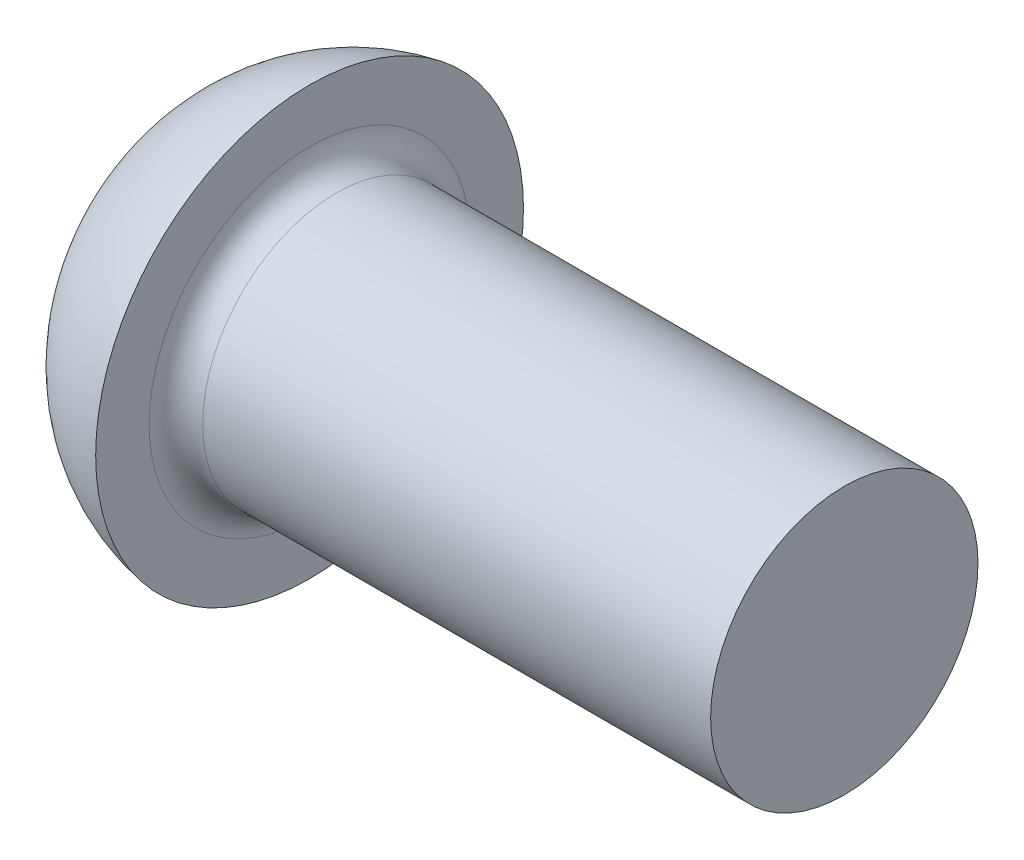
from build123d import *

# Parameters (mm, degrees)
FILLET2_R = 0.2


with BuildPart() as part:
    # Sketch1 → Revolve1 (revolve)
    with BuildSketch(Plane(origin=(0, 0, 0), x_dir=(1, 0, 0), z_dir=(0, 1, 0)), mode=Mode.PRIVATE) as revolve1_sk:
        with BuildLine():
            Line((1.2, 1), (5.2, 1))
            Line((5.2, 1), (5.2, 0))
            Line((5.2, 0), (0, 0))
            ThreePointArc((0, 0), (0.017270008, 0.28132505), (0.068820682, 0.55842533))
            ThreePointArc((0.068820682, 0.55842533), (0.478612062, 1.248413967), (1.2, 1.6))
            Line((1.2, 1.6), (1.2, 1))
        make_face()
    revolve(revolve1_sk.sketch.rotate(Axis((-13.629268293, 0, 0), (1, 0, 0)), 180), axis=Axis((-13.629268293, 0, 0), (1, 0, 0)))

    # Fillet2
    fillet2_edges = [part.edges().sort_by_distance(p)[0] for p in [
        (1.2, 0, -1),
    ]]
    fillet(fillet2_edges, radius=FILLET2_R)

    # Sketch4 → Cut-Revolve1 (revolve, cut)
    with BuildSketch(Plane(origin=(0, 0, 0), x_dir=(1, 0, 0), z_dir=(0, 1, 0)), mode=Mode.PRIVATE) as cut_revolve1_sk:
        Polygon((5.933454633, 0), (5.933454633, 21), (5.196334809, 21), (5.2, 0), align=None)
    revolve(cut_revolve1_sk.sketch.rotate(Axis((4.782773752, 0, 0), (1, 0, 0)), 180), axis=Axis((4.782773752, 0, 0), (1, 0, 0)), mode=Mode.SUBTRACT)

    # Sketch2 → Cut-Loft1 section 0
    with BuildSketch(Plane(origin=(0, 0, 0), x_dir=(0, 0, -1), z_dir=(1, 0, 0)), mode=Mode.PRIVATE) as cut_loft1_s0:
        with BuildLine():
            Line((-0.3125, 0.3125), (-1.25, 0.3125))
            Line((-1.25, 0.3125), (-1.25, -0.3125))
            Line((-1.25, -0.3125), (-0.3125, -0.3125))
            Line((-0.3125, -0.3125), (-0.3125, -1.25))
            Line((-0.3125, -1.25), (0.3125, -1.25))
            Line((0.3125, -1.25), (0.3125, -0.3125))
            Line((0.3125, -0.3125), (1.25, -0.3125))
            Line((1.25, -0.3125), (1.25, 0.3125))
            Line((1.25, 0.3125), (0.3125, 0.3125))
            Line((0.3125, 0.3125), (0.3125, 1.25))
            Line((0.3125, 1.25), (-0.3125, 1.25))
            Line((-0.3125, 1.25), (-0.3125, 0.3125))
        make_face()
    loft([Vertex(1.45, 0, 0), cut_loft1_s0.sketch], mode=Mode.SUBTRACT)


solid = part.part
